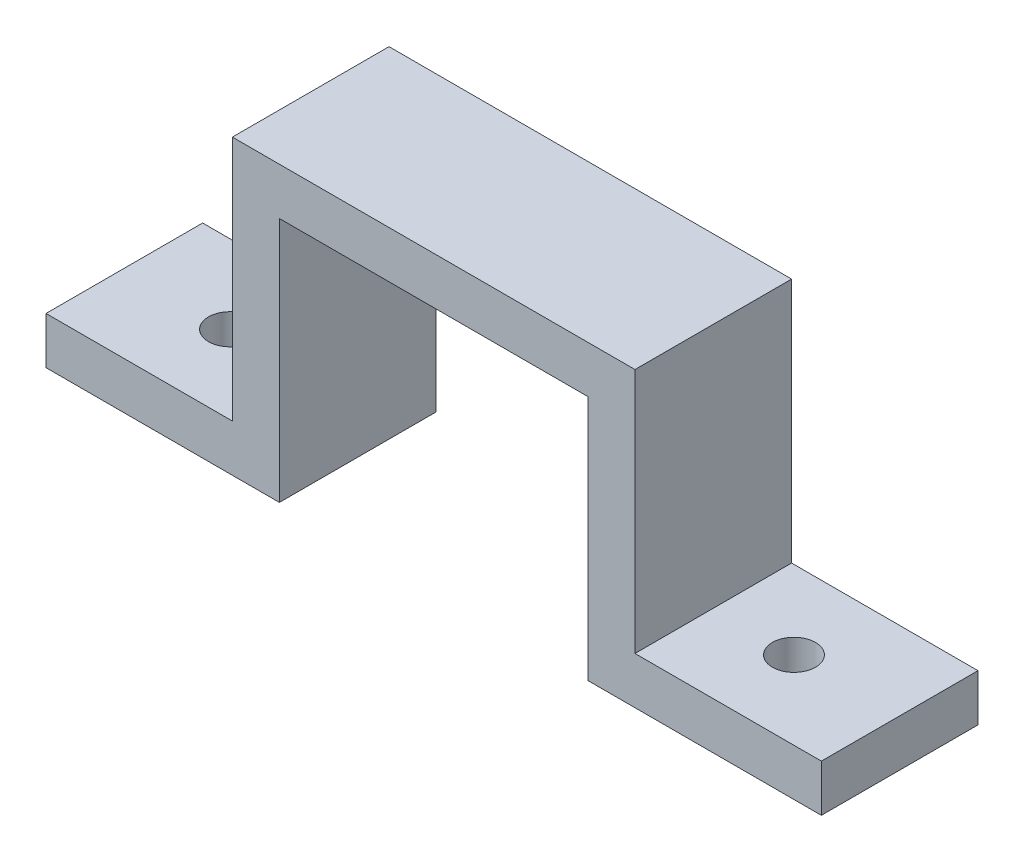
from build123d import *

# Parameters (mm, degrees)
SKETCH1_W             = 11.9
SKETCH1_H             = 10
SKETCH1_R             = 1.375
BOSS_EXTRUDE1_DEPTH   = 3
SKETCH1_W_2           = 11.89875271
BOSS_EXTRUDE1_2_DEPTH = 3
SKETCH1_4_W           = 3
SKETCH1_4_H           = 10
SKETCH1_4_W_2         = 3.00124729
BOSS_EXTRUDE2_DEPTH   = 18.7
BOSS_EXTRUDE3_REACH   = 42.581
SKETCH3_W             = 10
SKETCH3_H             = 3


with BuildPart() as part:
    # Sketch1 → Boss-Extrude1 (new body)
    with BuildSketch(Plane(origin=(0, 0, 0), x_dir=(1, 0, 0), z_dir=(0, 1, 0))):
        with Locations((43.55, -5)):
            Rectangle(SKETCH1_W, SKETCH1_H)
        with Locations((42.75, -5)):
            Circle(SKETCH1_R, mode=Mode.SUBTRACT)
    extrude(amount=BOSS_EXTRUDE1_DEPTH)



with BuildPart() as body_2:
    # Sketch1 → Boss-Extrude1 2 (new body)
    with BuildSketch(Plane(origin=(0, 0, 0), x_dir=(1, 0, 0), z_dir=(0, 1, 0))):
        with Locations((5.949376355, -5)):
            Rectangle(SKETCH1_W_2, SKETCH1_H)
        with Locations((6.75, -5)):
            Circle(SKETCH1_R, mode=Mode.SUBTRACT)
    extrude(amount=BOSS_EXTRUDE1_2_DEPTH)


with BuildPart() as part_1:
    add(part.part)

    add(body_2.part)  # Boss-Extrude2 merges body 2
    # Sketch1<4> → Boss-Extrude2 (add)
    with BuildSketch(Plane(origin=(0, 0, 0), x_dir=(1, 0, 0), z_dir=(0, 1, 0))):
        with Locations((36.1, -5)):
            Rectangle(SKETCH1_4_W, SKETCH1_4_H)
        with Locations((13.399376355, -5)):
            Rectangle(SKETCH1_4_W_2, SKETCH1_4_H)
    extrude(amount=BOSS_EXTRUDE2_DEPTH)

    # Sketch3 → Boss-Extrude3 (add, up to next)
    with BuildSketch(Plane(origin=(14.9, 0, 0), x_dir=(0, 0, -1), z_dir=(1, 0, 0)), mode=Mode.PRIVATE) as boss_extrude3_sk1:
        with Locations((-5, 17.2)):
            Rectangle(SKETCH3_W, SKETCH3_H)
    boss_extrude3_tool1 = extrude(boss_extrude3_sk1.sketch, amount=BOSS_EXTRUDE3_REACH, mode=Mode.PRIVATE) - part_1.part
    add(boss_extrude3_tool1.solids().sort_by_distance((14.9, 17.2, 5))[0])


solid = part_1.part
